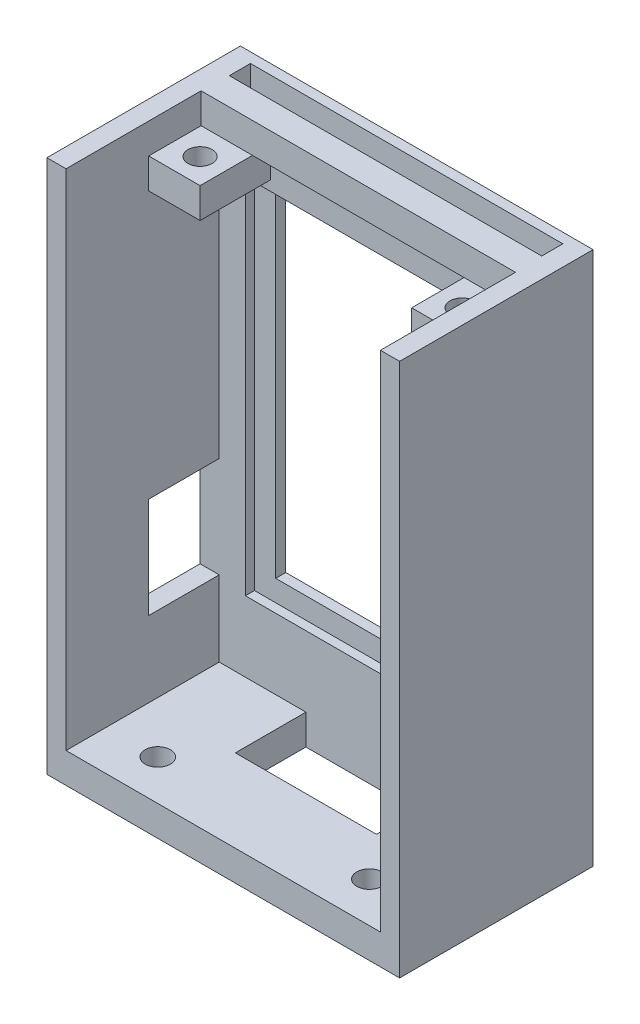
from build123d import *

# Parameters (mm, degrees)
SKETCH_1_W           = 35
SKETCH_1_H           = 53
EXTRUDE_1_DEPTH      = 2
SKETCH_2_W           = 2
SKETCH_2_H           = 53
EXTRUDE_2_DEPTH      = 13.2
SKETCH_3_W           = 31
SKETCH_3_H           = 3
EXTRUDE_3_DEPTH      = 7.2
SKETCH_4_W           = 31
SKETCH_4_H           = 3
EXTRUDE_4_DEPTH      = 13.2
CUT_EXTRUDE_1_REACH  = 57.956
SKETCH_5_R           = 1.25
SKETCH_7_W           = 31
SKETCH_7_H           = 3
CUT_EXTRUDE_2_DEPTH  = 2.2
SKETCH_8_W           = 31
SKETCH_8_H           = 3
CUT_EXTRUDE_3_DEPTH  = 2
SKETCH_10_W          = 11
SKETCH_10_H          = 3
CUT_EXTRUDE_4_DEPTH  = 4
CUT_EXTRUDE_START    = -3
SKETCH_9_R           = 1.25
CUT_EXTRUDE_5_DEPTH  = 3
SKETCH_14_W          = 31
SKETCH_14_H          = 3
CUT_EXTRUDE_8_DEPTH  = 5
SKETCH_15_W          = 35
SKETCH_15_H          = 53
SKETCH_15_W_2        = 26
SKETCH_15_H_2        = 36
EXTRUDE_5_DEPTH      = 1
SKETCH_15_3_W        = 26
SKETCH_15_3_H        = 36
CUT_EXTRUDE_9_DEPTH  = 2
SKETCH_15_4_W        = 35
SKETCH_15_4_H        = 53
SKETCH_15_4_W_2      = 26
SKETCH_15_4_H_2      = 36
EXTRUDE_6_DEPTH      = 1
SKETCH_14_2_W        = 31
SKETCH_14_2_H        = 3
CUT_EXTRUDE_10_DEPTH = 7.2
SKETCH_21_W          = 31
SKETCH_21_H          = 3
CUT_EXTRUDE_11_DEPTH = 4
SKETCH_9_6_W         = 31
SKETCH_9_6_H         = 4
SKETCH_9_6_R         = 1.25
EXTRUDE_8_DEPTH      = 3
SKETCH_9_7_W         = 31
SKETCH_9_7_H         = 4
SKETCH_9_7_R         = 1.25
CUT_EXTRUDE_12_DEPTH = 3
SKETCH_23_W          = 31
SKETCH_23_H          = 3
EXTRUDE_9_DEPTH      = 2
SKETCH_24_W          = 31
SKETCH_24_H          = 3
CUT_EXTRUDE_13_DEPTH = 7.2
SKETCH_25_R          = 1.2
CUT_EXTRUDE_14_DEPTH = 3
SKETCH_15_5_W        = 35
SKETCH_15_5_H        = 53
SKETCH_15_5_W_2      = 26
SKETCH_15_5_H_2      = 36
EXTRUDE_10_DEPTH     = 2
SKETCH_28_W          = 31
SKETCH_28_H          = 2.1
CUT_EXTRUDE_15_DEPTH = 47
SKETCH_21_2_W        = 31
SKETCH_21_2_H        = 3
CUT_EXTRUDE_16_DEPTH = 6
SKETCH_12_W          = 2
SKETCH_12_H          = 10
CUT_EXTRUDE_17_DEPTH = 13.2
SKETCH_12_2_W        = 2
SKETCH_12_2_H        = 10
EXTRUDE_11_DEPTH     = 8.2
SKETCH_33_W          = 14
SKETCH_33_H          = 5
CUT_EXTRUDE_18_DEPTH = 3
SKETCH_34_W          = 21
SKETCH_34_H          = 3
CUT_EXTRUDE_19_DEPTH = 5
CUT_EXTRUDE_20_DEPTH = 0.1
CUT_EXTRUDE_21_DEPTH = 0.1
SKETCH_38_W          = 31
SKETCH_38_H          = 47
SKETCH_38_W_2        = 26
SKETCH_38_H_2        = 36
EXTRUDE_12_DEPTH     = 2
SKETCH_39_W          = 26
SKETCH_39_H          = 36
CUT_EXTRUDE_22_DEPTH = 2
SKETCH_40_W          = 35
SKETCH_40_H          = 53
SKETCH_40_W_2        = 26
SKETCH_40_H_2        = 36
EXTRUDE_13_DEPTH     = 2
SKETCH_41_W          = 31
SKETCH_41_H          = 47
SKETCH_41_W_2        = 26
SKETCH_41_H_2        = 36
CUT_EXTRUDE_23_DEPTH = 2
EXTRUDE_14_DEPTH     = 1.8


with BuildPart() as part:
    # 草图1 → 凸台-拉伸1 (new body)
    with BuildSketch(Plane.XY):
        with Locations((2.5, -6.5)):
            Rectangle(SKETCH_1_W, SKETCH_1_H)
    extrude(amount=EXTRUDE_1_DEPTH)

    # 草图2 → 凸台-拉伸2 (add)
    with BuildSketch(Plane.XY.offset(2)):
        with Locations((-14, -6.5)):
            Rectangle(SKETCH_2_W, SKETCH_2_H)
        with Locations((19, -6.5)):
            Rectangle(SKETCH_2_W, SKETCH_2_H)
    extrude(amount=EXTRUDE_2_DEPTH)

    # 草图3 → 凸台-拉伸3 (add)
    with BuildSketch(Plane.XY.offset(2)):
        with Locations((2.5, 18.5)):
            Rectangle(SKETCH_3_W, SKETCH_3_H)
        with Locations((2.5, -31.5)):
            Rectangle(SKETCH_3_W, SKETCH_3_H)
    extrude(amount=EXTRUDE_3_DEPTH)

    # 草图4 → 凸台-拉伸4 (add)
    with BuildSketch(Plane.XY.offset(2)):
        with Locations((2.5, 15.5)):
            Rectangle(SKETCH_4_W, SKETCH_4_H)
        with Locations((2.5, -28.5)):
            Rectangle(SKETCH_4_W, SKETCH_4_H)
    extrude(amount=EXTRUDE_4_DEPTH)

    # 草图5 → 切除-拉伸1 (cut, up to next)
    with BuildSketch(Plane(origin=(0, 17, 0), x_dir=(1, 0, 0), z_dir=(0, 1, 0)), mode=Mode.PRIVATE) as cut_extrude_1_sk1:
        with Locations(Location((-8, -11.2, 0), (0, 0, 270))):
            Circle(SKETCH_5_R)
    cut_extrude_1_tool1 = extrude(cut_extrude_1_sk1.sketch, amount=-CUT_EXTRUDE_1_REACH, mode=Mode.PRIVATE) & part.part
    # 草图5 → 切除-拉伸1 (cut, up to next)
    with BuildSketch(Plane(origin=(0, 17, 0), x_dir=(1, 0, 0), z_dir=(0, 1, 0)), mode=Mode.PRIVATE) as cut_extrude_1_sk2:
        with Locations(Location((2.5, -11.2, 0), (0, 0, 270))):
            Circle(SKETCH_5_R)
    cut_extrude_1_tool2 = extrude(cut_extrude_1_sk2.sketch, amount=-CUT_EXTRUDE_1_REACH, mode=Mode.PRIVATE) & part.part
    # 草图5 → 切除-拉伸1 (cut, up to next)
    with BuildSketch(Plane(origin=(0, 17, 0), x_dir=(1, 0, 0), z_dir=(0, 1, 0)), mode=Mode.PRIVATE) as cut_extrude_1_sk3:
        with Locations(Location((13, -11.2, 0), (0, 0, 270))):
            Circle(SKETCH_5_R)
    cut_extrude_1_tool3 = extrude(cut_extrude_1_sk3.sketch, amount=-CUT_EXTRUDE_1_REACH, mode=Mode.PRIVATE) & part.part
    add(cut_extrude_1_tool1.solids().sort_by_distance((-8, 17, 11.2))[0], mode=Mode.SUBTRACT)
    add(cut_extrude_1_tool2.solids().sort_by_distance((2.5, 17, 11.2))[0], mode=Mode.SUBTRACT)
    add(cut_extrude_1_tool3.solids().sort_by_distance((13, 17, 11.2))[0], mode=Mode.SUBTRACT)

    # 草图7 → 切除-拉伸2 (cut)
    with BuildSketch(Plane.XY.offset(15.2)):
        with Locations((2.5, 15.5)):
            Rectangle(SKETCH_7_W, SKETCH_7_H)
    extrude(amount=-CUT_EXTRUDE_2_DEPTH, mode=Mode.SUBTRACT)

    # 草图8 → 切除-拉伸3 (cut)
    with BuildSketch(Plane.XY.offset(15.2)):
        with Locations((2.5, -28.5)):
            Rectangle(SKETCH_8_W, SKETCH_8_H)
    extrude(amount=-CUT_EXTRUDE_3_DEPTH, mode=Mode.SUBTRACT)

    # 草图10 → 切除-拉伸4 (cut)
    with BuildSketch(Plane.XY.offset(13.2)):
        with Locations((2.5, -28.5)):
            Rectangle(SKETCH_10_W, SKETCH_10_H)
    extrude(amount=-CUT_EXTRUDE_4_DEPTH, mode=Mode.SUBTRACT)

    # 草图9 → 切除-拉伸5 (cut)
    with BuildSketch(Plane.XZ.offset(30).offset(CUT_EXTRUDE_START)):
        with Locations(Location((-8, 11.2, 0), (0, 0, 90))):
            Circle(SKETCH_9_R)
        with Locations(Location((13, 11.2, 0), (0, 0, 90))):
            Circle(SKETCH_9_R)
    extrude(amount=CUT_EXTRUDE_5_DEPTH, mode=Mode.SUBTRACT)

    # 草图14 → 切除-拉伸8 (cut)
    with BuildSketch(Plane.XY.offset(9.2)):
        with Locations((2.5, 18.5)):
            Rectangle(SKETCH_14_W, SKETCH_14_H)
    extrude(amount=-CUT_EXTRUDE_8_DEPTH, mode=Mode.SUBTRACT)

    # 草图15 → 凸台-拉伸5 (add)
    with BuildSketch(Plane(origin=(0, 0, 0), x_dir=(-1, 0, 0), z_dir=(0, 0, -1))):
        with Locations((-2.5, -6.5)):
            Rectangle(SKETCH_15_W, SKETCH_15_H)
        with Locations((-2.5, -5)):
            Rectangle(SKETCH_15_W_2, SKETCH_15_H_2, mode=Mode.SUBTRACT)
    extrude(amount=EXTRUDE_5_DEPTH)

    # 草图15<3> → 切除-拉伸9 (cut)
    with BuildSketch(Plane(origin=(0, 0, 0), x_dir=(-1, 0, 0), z_dir=(0, 0, -1))):
        with Locations((-2.5, -5)):
            Rectangle(SKETCH_15_3_W, SKETCH_15_3_H)
    extrude(amount=-CUT_EXTRUDE_9_DEPTH, mode=Mode.SUBTRACT)

    # 草图15<4> → 凸台-拉伸6 (add)
    with BuildSketch(Plane(origin=(0, 0, 0), x_dir=(-1, 0, 0), z_dir=(0, 0, -1))):
        with Locations((-2.5, -6.5)):
            Rectangle(SKETCH_15_4_W, SKETCH_15_4_H)
        with Locations((-2.5, -5)):
            Rectangle(SKETCH_15_4_W_2, SKETCH_15_4_H_2, mode=Mode.SUBTRACT)
    extrude(amount=EXTRUDE_6_DEPTH)

    # 草图14<2> → 切除-拉伸10 (cut)
    with BuildSketch(Plane.XY.offset(9.2)):
        with Locations((2.5, 18.5)):
            Rectangle(SKETCH_14_2_W, SKETCH_14_2_H)
    extrude(amount=-CUT_EXTRUDE_10_DEPTH, mode=Mode.SUBTRACT)

    # 草图21 → 切除-拉伸11 (cut)
    with BuildSketch(Plane.XY.offset(13)):
        with Locations((2.5, 15.5)):
            Rectangle(SKETCH_21_W, SKETCH_21_H)
    extrude(amount=-CUT_EXTRUDE_11_DEPTH, mode=Mode.SUBTRACT)

    # 草图9<6> → 凸台-拉伸8 (add)
    with BuildSketch(Plane.XZ.offset(30)):
        with Locations((2.5, 11.2)):
            Rectangle(SKETCH_9_6_W, SKETCH_9_6_H)
        with Locations((13, 11.2)):
            Circle(SKETCH_9_6_R, mode=Mode.SUBTRACT)
        with Locations((-8, 11.2)):
            Circle(SKETCH_9_6_R, mode=Mode.SUBTRACT)
    extrude(amount=EXTRUDE_8_DEPTH)

    # 草图9<7> → 切除-拉伸12 (cut)
    with BuildSketch(Plane.XZ.offset(30).offset(CUT_EXTRUDE_START)):
        with Locations((2.5, 11.2)):
            Rectangle(SKETCH_9_7_W, SKETCH_9_7_H)
        with Locations(Location((13, 11.2, 0), (0, 0, 270))):
            Circle(SKETCH_9_7_R, mode=Mode.SUBTRACT)
        with Locations(Location((-8, 11.2, 0), (0, 0, 270))):
            Circle(SKETCH_9_7_R, mode=Mode.SUBTRACT)
    extrude(amount=CUT_EXTRUDE_12_DEPTH, mode=Mode.SUBTRACT)

    # 草图23 → 凸台-拉伸9 (add)
    with BuildSketch(Plane.XY.offset(13.2)):
        with Locations((2.5, -31.5)):
            Rectangle(SKETCH_23_W, SKETCH_23_H)
    extrude(amount=EXTRUDE_9_DEPTH)

    # 草图24 → 切除-拉伸13 (cut)
    with BuildSketch(Plane.XY.offset(9.2)):
        with Locations((2.5, -28.5)):
            Rectangle(SKETCH_24_W, SKETCH_24_H)
    extrude(amount=-CUT_EXTRUDE_13_DEPTH, mode=Mode.SUBTRACT)

    # 草图25 → 切除-拉伸14 (cut)
    with BuildSketch(Plane(origin=(0, 17, 0), x_dir=(1, 0, 0), z_dir=(0, 1, 0))):
        with Locations(Location((-10.5, -4.5, 0), (0, 0, 270))):
            Circle(SKETCH_25_R)
        with Locations(Location((15.5, -4.5, 0), (0, 0, 270))):
            Circle(SKETCH_25_R)
    extrude(amount=-CUT_EXTRUDE_14_DEPTH, mode=Mode.SUBTRACT)

    # 草图15<5> → 凸台-拉伸10 (add)
    with BuildSketch(Plane(origin=(0, 0, 0), x_dir=(-1, 0, 0), z_dir=(0, 0, -1))):
        with Locations((-2.5, -6.5)):
            Rectangle(SKETCH_15_5_W, SKETCH_15_5_H)
        with Locations((-2.5, -5)):
            Rectangle(SKETCH_15_5_W_2, SKETCH_15_5_H_2, mode=Mode.SUBTRACT)
    extrude(amount=EXTRUDE_10_DEPTH)

    # 草图28 → 切除-拉伸15 (cut)
    with BuildSketch(Plane(origin=(0, 20, 0), x_dir=(1, 0, 0), z_dir=(0, 1, 0))):
        with Locations((2.5, -0.05)):
            Rectangle(SKETCH_28_W, SKETCH_28_H)
    extrude(amount=-CUT_EXTRUDE_15_DEPTH, mode=Mode.SUBTRACT)

    # 草图21<2> → 切除-拉伸16 (cut)
    with BuildSketch(Plane.XY.offset(13)):
        with Locations((2.5, 15.5)):
            Rectangle(SKETCH_21_2_W, SKETCH_21_2_H)
    extrude(amount=-CUT_EXTRUDE_16_DEPTH, mode=Mode.SUBTRACT)

    # 草图12 → 切除-拉伸17 (cut)
    with BuildSketch(Plane.XY.offset(15.2)):
        with Locations((-14, -17.5)):
            Rectangle(SKETCH_12_W, SKETCH_12_H)
    extrude(amount=-CUT_EXTRUDE_17_DEPTH, mode=Mode.SUBTRACT)

    # 草图12<2> → 凸台-拉伸11 (add)
    with BuildSketch(Plane.XY.offset(15.2)):
        with Locations((-14, -17.5)):
            Rectangle(SKETCH_12_2_W, SKETCH_12_2_H)
    extrude(amount=-EXTRUDE_11_DEPTH)

    # 草图33 → 切除-拉伸18 (cut)
    with BuildSketch(Plane.XZ.offset(33)):
        with Locations((2.5, 4.5)):
            Rectangle(SKETCH_33_W, SKETCH_33_H)
    extrude(amount=-CUT_EXTRUDE_18_DEPTH, mode=Mode.SUBTRACT)

    # 草图34 → 切除-拉伸19 (cut)
    with BuildSketch(Plane.XY.offset(7)):
        with Locations((2.5, 15.5)):
            Rectangle(SKETCH_34_W, SKETCH_34_H)
    extrude(amount=-CUT_EXTRUDE_19_DEPTH, mode=Mode.SUBTRACT)

    # 草图35 → 切除-拉伸20 (cut)
    with BuildSketch(Plane.ZY.offset(-18)):
        Polygon((2, 20), (2, 17), (7, 17), (7, 14), (2, 14), (2, -30), (15.2, -30), (15.2, 20), align=None)
    extrude(amount=-CUT_EXTRUDE_20_DEPTH, mode=Mode.SUBTRACT)

    # 草图36 → 切除-拉伸21 (cut)
    with BuildSketch(Plane(origin=(-13, 0, 0), x_dir=(0, 0, -1), z_dir=(1, 0, 0))):
        Polygon((-15.2, -30), (-2, -30), (-2, -22.5), (-7, -22.5), (-7, -12.5), (-2, -12.5), (-2, 14), (-7, 14), (-7, 17), (-2, 17), (-2, 20), (-15.2, 20), align=None)
    extrude(amount=-CUT_EXTRUDE_21_DEPTH, mode=Mode.SUBTRACT)

    # 草图38 → 凸台-拉伸12 (add)
    with BuildSketch(Plane(origin=(0, 0, 1.1), x_dir=(-1, 0, 0), z_dir=(0, 0, -1))):
        with Locations((-2.5, -3.5)):
            Rectangle(SKETCH_38_W, SKETCH_38_H)
        with Locations((-2.5, -5)):
            Rectangle(SKETCH_38_W_2, SKETCH_38_H_2, mode=Mode.SUBTRACT)
    extrude(amount=EXTRUDE_12_DEPTH)

    # 草图39 → 切除-拉伸22 (cut)
    with BuildSketch(Plane.XY.offset(2)):
        Polygon((-15, -12.5), (-15, -22.5), (-13.1, -22.5), (-13.1, -30), (-4.5, -30), (-4.5, -33), (9.5, -33), (9.5, -30), (18.1, -30), (18.1, 14), (13, 14), (13, 17), (18.1, 17), (18.1, 20), (-13.1, 20), (-13.1, 17), (-8, 17), (-8, 14), (-13.1, 14), (-13.1, -12.5), align=None)
        with Locations((2.5, -5)):
            Rectangle(SKETCH_39_W, SKETCH_39_H, mode=Mode.SUBTRACT)
    extrude(amount=-CUT_EXTRUDE_22_DEPTH, mode=Mode.SUBTRACT)

    # 草图40 → 凸台-拉伸13 (add)
    with BuildSketch(Plane(origin=(0, 0, -2), x_dir=(-1, 0, 0), z_dir=(0, 0, -1))):
        with Locations((-2.5, -6.5)):
            Rectangle(SKETCH_40_W, SKETCH_40_H)
        with Locations((-2.5, -5)):
            Rectangle(SKETCH_40_W_2, SKETCH_40_H_2, mode=Mode.SUBTRACT)
    extrude(amount=EXTRUDE_13_DEPTH)

    # 草图41 → 切除-拉伸23 (cut)
    with BuildSketch(Plane.XY.offset(-1)):
        with Locations((2.5, -3.5)):
            Rectangle(SKETCH_41_W, SKETCH_41_H)
        with Locations((2.5, -5)):
            Rectangle(SKETCH_41_W_2, SKETCH_41_H_2, mode=Mode.SUBTRACT)
    extrude(amount=-CUT_EXTRUDE_23_DEPTH, mode=Mode.SUBTRACT)

    # 草图42 → 凸台-拉伸14 (add)
    with BuildSketch(Plane.XY):
        Polygon((-8, 17), (13, 17), (18.1, 17), (18.1, 20), (-13.1, 20), (-13.1, 17), align=None)
    extrude(amount=EXTRUDE_14_DEPTH)


solid = part.part
